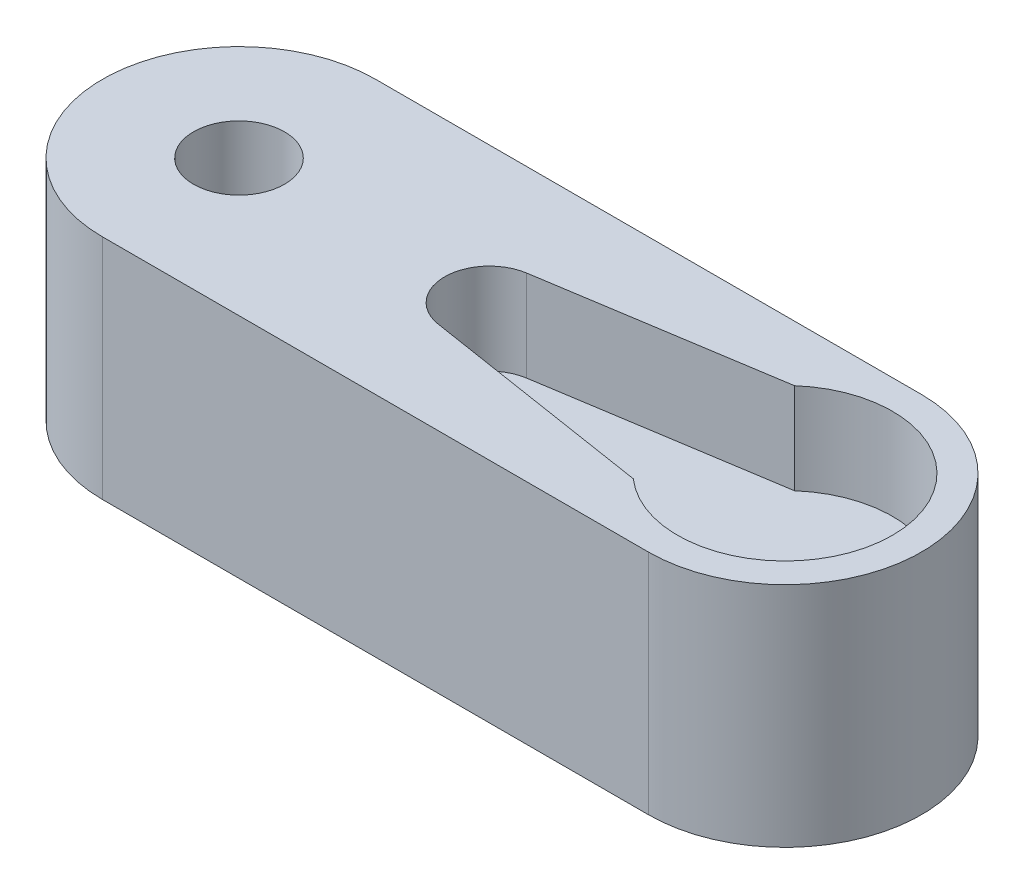
from build123d import *

# Parameters (mm, degrees)
BOSS_EXTRUDE1_DEPTH = 12.7
SKETCH4_R           = 2.54
CUT_EXTRUDE3_DEPTH  = 37.189429396
CUT_EXTRUDE4_DEPTH  = 5.08


with BuildPart() as part:
    # Sketch3 → Boss-Extrude1 (new body)
    with BuildSketch(Plane(origin=(0, 0, 0), x_dir=(1, 0, 0), z_dir=(0, 1, 0))):
        with BuildLine():
            Line((-25.4, 7.62), (5.08, 7.62))
            ThreePointArc((5.08, 7.62), (12.7, 0), (5.08, -7.62))
            Line((5.08, -7.62), (-25.4, -7.62))
            ThreePointArc((-25.4, -7.62), (-33.02, 0), (-25.4, 7.62))
        make_face()
    extrude(amount=BOSS_EXTRUDE1_DEPTH)

    # Sketch4 → Cut-Extrude3 (cut, through all)
    with BuildSketch(Plane(origin=(0, 12.7, 0), x_dir=(1, 0, 0), z_dir=(0, 1, 0))):
        with Locations(Location((-25.4, 0, 0), (0, 0, 270))):
            Circle(SKETCH4_R)
    extrude(amount=-CUT_EXTRUDE3_DEPTH, mode=Mode.SUBTRACT)

    # Sketch5 → Cut-Extrude4 (cut)
    with BuildSketch(Plane(origin=(0, 12.7, 0), x_dir=(1, 0, 0), z_dir=(0, 1, 0))):
        with BuildLine():
            Line((-11.808123317, -2.469691065), (1.11137089, -4.50000243))
            ThreePointArc((1.11137089, -4.50000243), (11.08000324, 0), (1.11137089, 4.50000243))
            Line((1.11137089, 4.50000243), (-11.808123317, 2.469691065))
            ThreePointArc((-11.808123317, 2.469691065), (-13.92001026, 0), (-11.808123317, -2.469691065))
        make_face()
    extrude(amount=-CUT_EXTRUDE4_DEPTH, mode=Mode.SUBTRACT)


solid = part.part
